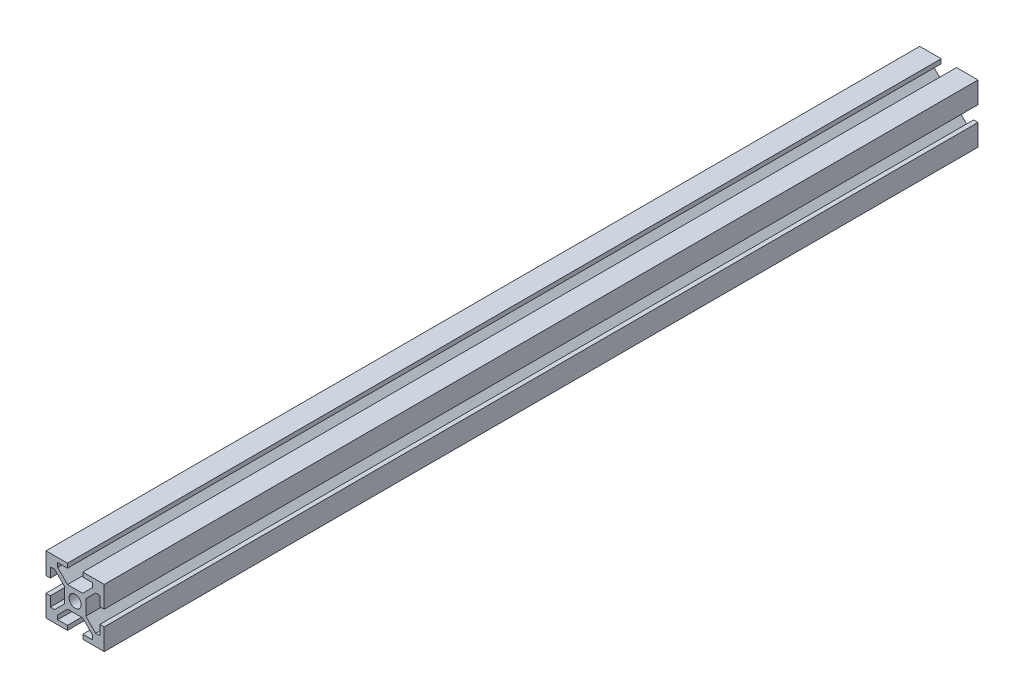
from build123d import *

# Parameters (mm, degrees)
ESQUISSE1_R        = 2.095
BOSS_EXTRU_1_DEPTH = 300


with BuildPart() as part:
    # Esquisse1 → Boss.-Extru.1 (new body)
    with BuildSketch(Plane.XY):
        Polygon((-3.643976848, 16.5527337), (-8.842656504, 16.5527337), (-12.238316676, 19.948393872), (-12.238316676, 21.3927337), (-8.873316676, 21.3927337), (-8.873316676, 22.8927337), (-16.243316676, 22.8927337), (-16.243316676, 15.5227337), (-14.743316676, 15.5227337), (-14.743316676, 18.8877337), (-13.298976848, 18.8877337), (-9.903316676, 15.492073528), (-9.903316676, 10.293393872), (-13.298976848, 6.8977337), (-14.743316676, 6.8977337), (-14.743316676, 10.2627337), (-16.243316676, 10.2627337), (-16.243316676, 2.8927337), (-8.873316676, 2.8927337), (-8.873316676, 4.3927337), (-12.238316676, 4.3927337), (-12.238316676, 5.837073528), (-8.842656504, 9.2327337), (-3.643976848, 9.2327337), (-0.248316676, 5.837073528), (-0.248316676, 4.3927337), (-3.613316676, 4.3927337), (-3.613316676, 2.8927337), (3.756683324, 2.8927337), (3.756683324, 10.2627337), (2.256683324, 10.2627337), (2.256683324, 6.8977337), (0.812343496, 6.8977337), (-2.583316676, 10.293393872), (-2.583316676, 15.492073528), (0.812343496, 18.8877337), (2.256683324, 18.8877337), (2.256683324, 15.5227337), (3.756683324, 15.5227337), (3.756683324, 22.8927337), (-3.613316676, 22.8927337), (-3.613316676, 21.3927337), (-0.248316676, 21.3927337), (-0.248316676, 19.948393872), align=None)
        with Locations((-6.243316676, 12.8927337)):
            Circle(ESQUISSE1_R, mode=Mode.SUBTRACT)
    extrude(amount=BOSS_EXTRU_1_DEPTH)


solid = part.part
